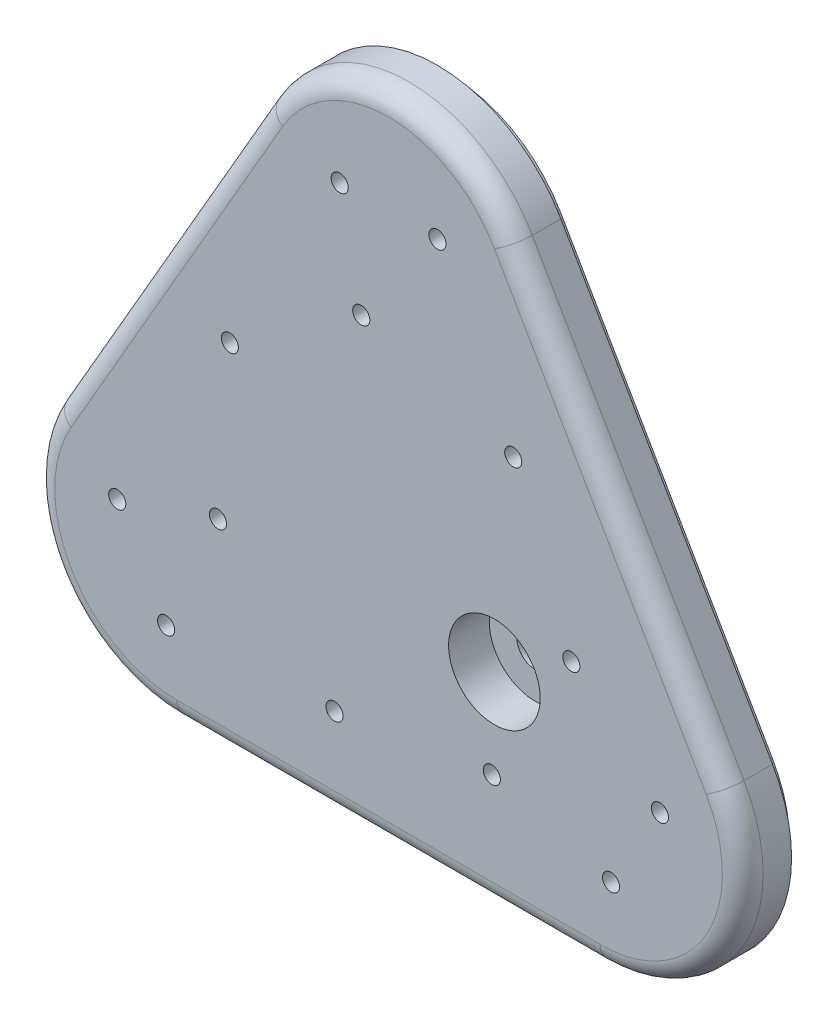
from build123d import *

# Parameters (mm, degrees)
ESBO_O1_R                = 2.1
ESBO_O1_R_2              = 4.5
RESSALTO_EXTRUS_O1_DEPTH = 15
ESBO_O2_R                = 2.1
CORTE_EXTRUS_O1_DEPTH    = 15
CORTE_EXTRUS_O2_DEPTH    = 3
ESBO_O5_R                = 11.25
CORTE_EXTRUS_O3_DEPTH    = 10
FILETE1_R                = 5


with BuildPart() as part:
    # Esboço1 → Ressalto-extrusão1 (new body)
    with BuildSketch(Plane.XY):
        with BuildLine():
            Line((-30.310889132, 77.5), (-82.27241336, -12.5))
            ThreePointArc((-82.27241336, -12.5), (-82.27241336, -47.5), (-51.961524227, -65))
            Line((-51.961524227, -65), (51.961524227, -65))
            ThreePointArc((51.961524227, -65), (82.27241336, -47.5), (82.27241336, -12.5))
            Line((82.27241336, -12.5), (30.310889132, 77.5))
            ThreePointArc((30.310889132, 77.5), (0, 95), (-30.310889132, 77.5))
        make_face()
        with Locations((-12, 70)):
            Circle(ESBO_O1_R, mode=Mode.SUBTRACT)
        with Locations((-66.621778265, -24.607695155)):
            Circle(ESBO_O1_R, mode=Mode.SUBTRACT)
        with Locations(Location((12, 70, 0), (0, 0, 180))):
            Circle(ESBO_O1_R, mode=Mode.SUBTRACT)
        with Locations(Location((-54.621778265, -45.392304845, 0), (0, 0, 180))):
            Circle(ESBO_O1_R, mode=Mode.SUBTRACT)
        with Locations((66.621778265, -24.607695155)):
            Circle(ESBO_O1_R, mode=Mode.SUBTRACT)
        with Locations((54.621778265, -45.392304845)):
            Circle(ESBO_O1_R, mode=Mode.SUBTRACT)
        with Locations((25.980762114, -15)):
            Circle(ESBO_O1_R_2, mode=Mode.SUBTRACT)
    extrude(amount=RESSALTO_EXTRUS_O1_DEPTH)

    # Esboço2 → Corte-extrusão1 (cut)
    with BuildSketch(Plane(origin=(0, 0, 0), x_dir=(-1, 0, 0), z_dir=(0, 0, -1))):
        with Locations((38.97114317, 22.5)):
            Circle(ESBO_O2_R)
        with Locations((41.889318689, -16.440346096)):
            Circle(ESBO_O2_R)
        with Locations((13.263982849, -43.00077626)):
            Circle(ESBO_O2_R)
        with Locations((-25.349402613, -37.180744844)):
            Circle(ESBO_O2_R)
        with Locations((-44.874170873, -3.362854211)):
            Circle(ESBO_O2_R)
        with Locations((-30.6077732, 32.987334232)):
            Circle(ESBO_O2_R)
        with Locations((6.706901978, 44.49738718)):
            Circle(ESBO_O2_R)
    extrude(amount=-CORTE_EXTRUS_O1_DEPTH, mode=Mode.SUBTRACT)

    # Esboço4 → Corte-extrusão2 (cut)
    with BuildSketch(Plane(origin=(0, 0, 0), x_dir=(-1, 0, 0), z_dir=(0, 0, -1))):
        with BuildLine():
            Line((51.961524227, -65), (-51.961524227, -65))
            ThreePointArc((-51.961524227, -65), (-82.27241336, -47.5), (-82.27241336, -12.5))
            Line((-82.27241336, -12.5), (-30.310889132, 77.5))
            ThreePointArc((-30.310889132, 77.5), (0, 95), (30.310889132, 77.5))
            Line((30.310889132, 77.5), (82.27241336, -12.5))
            ThreePointArc((82.27241336, -12.5), (82.27241336, -47.5), (51.961524227, -65))
        make_face()
        with BuildLine():
            Line((51.961524227, -61.5), (-51.961524227, -61.5))
            ThreePointArc((-51.961524227, -61.5), (-79.241324446, -45.75), (-79.241324446, -14.25))
            Line((-79.241324446, -14.25), (-27.279800219, 75.75))
            ThreePointArc((-27.279800219, 75.75), (0, 91.5), (27.279800219, 75.75))
            Line((27.279800219, 75.75), (79.241324446, -14.25))
            ThreePointArc((79.241324446, -14.25), (79.241324446, -45.75), (51.961524227, -61.5))
        make_face(mode=Mode.SUBTRACT)
    extrude(amount=-CORTE_EXTRUS_O2_DEPTH, mode=Mode.SUBTRACT)

    # Esboço5 → Corte-extrusão3 (cut)
    with BuildSketch(Plane.XY.offset(15)):
        with Locations((25.980762114, -15)):
            Circle(ESBO_O5_R)
    extrude(amount=-CORTE_EXTRUS_O3_DEPTH, mode=Mode.SUBTRACT)

    # Filete1
    filete1_edges = [part.edges().sort_by_distance(p)[0] for p in [
        (-82.27241336, -47.5, 15),
        (0, -65, 15),
        (82.27241336, -47.5, 15),
        (56.291651246, 32.5, 15),
        (0, 95, 15),
        (-56.291651246, 32.5, 15),
    ]]
    fillet(filete1_edges, radius=FILETE1_R)


solid = part.part
